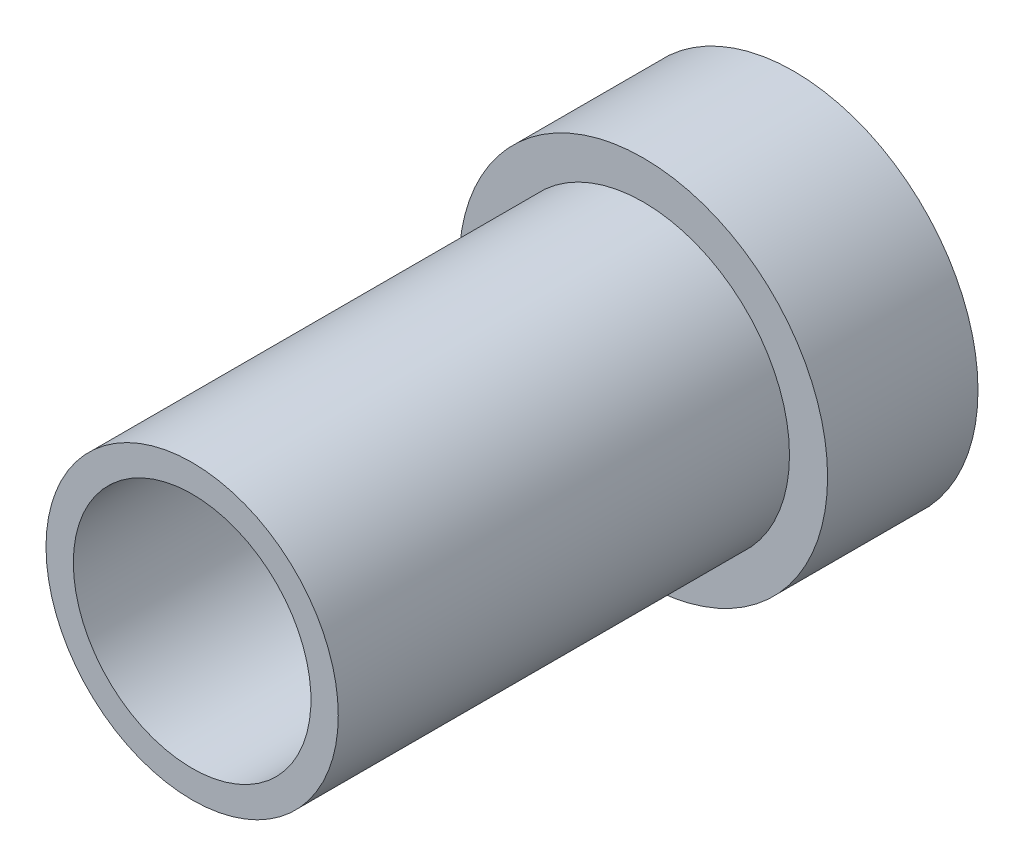
from build123d import *


with BuildPart() as part:
    # Esboço1 → Revolução1 (revolve)
    with BuildSketch(Plane.XZ, mode=Mode.PRIVATE) as revolu_o1_sk:
        Polygon((18.255, 0), (24.5, 0), (24.5, 20), (19.432358697, 20), (19.432358697, 80), (15.8, 80), (15.8, 20), (18.255, 20), align=None)
    revolve(revolu_o1_sk.sketch.rotate(Axis((0, 0, 80), (0, 0, -1)), 180), axis=Axis((0, 0, 80), (0, 0, -1)))


solid = part.part
